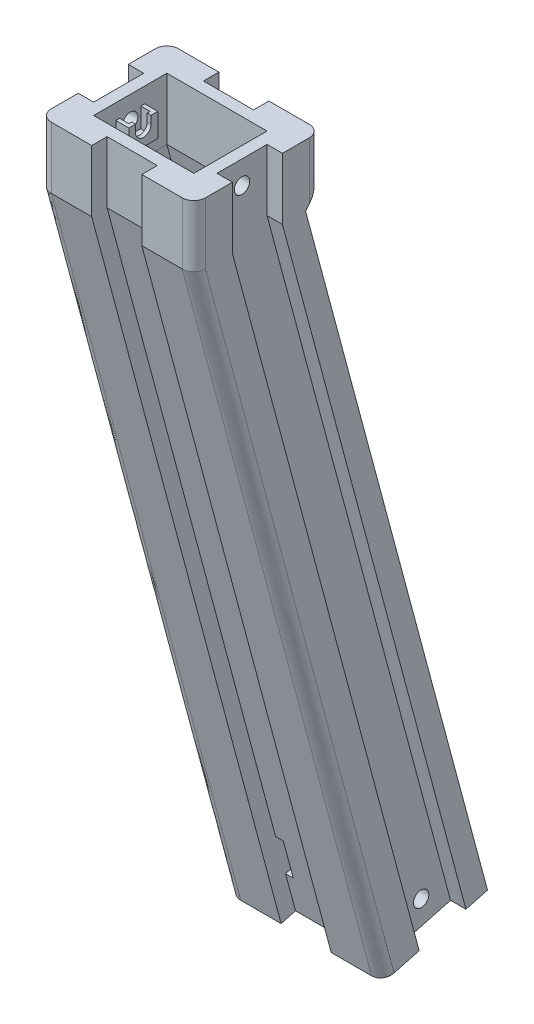
from build123d import *

# Parameters (mm, degrees)
BOSS_EXTRUDE1_DEPTH      = 16
SKETCH3_R                = 2
CUT_EXTRUDE1_DEPTH       = 55.267854205
SKETCH14_W               = 13
SKETCH14_H               = 4
SKETCH14_W_2             = 4
SKETCH14_H_2             = 13
CUT_EXTRUDE12_DEPTH      = 42.773197148
CUT_EXTRUDE17_DEPTH      = 185.668050728
CUT_EXTRUDE17_DEPTH_BACK = 185.668050728
BOSS_EXTRUDE2_DEPTH      = 16
SKETCH23_R               = 2
CUT_EXTRUDE16_DEPTH      = 202.8916363
SKETCH25_W               = 26
SKETCH25_H               = 19
CUT_EXTRUDE18_DEPTH      = 16
CUT_EXTRUDE19_DEPTH      = 200.66029351
CUT_EXTRUDE19_DEPTH_BACK = 200.66029351
SKETCH30_W               = 8
SKETCH30_H               = 7
CUT_EXTRUDE20_DEPTH      = 10
BOSS_EXTRUDE5_DEPTH      = 2.4
BOSS_EXTRUDE6_DEPTH      = 2.4
BOSS_EXTRUDE7_START      = 1
BOSS_EXTRUDE7_DEPTH      = 1
BOSS_EXTRUDE8_DEPTH      = 1
SKETCH37_W               = 3.4
SKETCH37_H               = 7.5
BOSS_EXTRUDE9_DEPTH      = 8.2
SKETCH38_W               = 2.4
SKETCH38_H               = 5.5
CUT_EXTRUDE21_DEPTH      = 5.3
CUT_EXTRUDE26_DEPTH      = 201.864269668
CUT_EXTRUDE26_DEPTH_BACK = 201.864269668
SKETCH40_R               = 2
CUT_EXTRUDE27_DEPTH      = 21
CUT_EXTRUDE27_DEPTH_BACK = 2
CUT_EXTRUDE28_DEPTH      = 5
SKETCH43_W               = 2
SKETCH43_H               = 10
CUT_EXTRUDE29_DEPTH      = 5
CUT_EXTRUDE30_DEPTH      = 5


with BuildPart() as part:
    # Sketch2 → Boss-Extrude1 (new body)
    with BuildSketch(Plane(origin=(0, 0, 0), x_dir=(1, 0, 0), z_dir=(0, 1, 0))):
        with BuildLine():
            Line((0, 33), (-17, 33))
            ThreePointArc((-17, 33), (-19.121320344, 32.121320344), (-20, 30))
            Line((-20, 30), (-20, 3))
            ThreePointArc((-20, 3), (-19.121320344, 0.878679656), (-17, 0))
            Line((-17, 0), (0, 0))
            Line((0, 0), (17, 0))
            ThreePointArc((17, 0), (19.121320344, 0.878679656), (20, 3))
            Line((20, 3), (20, 30))
            ThreePointArc((20, 30), (19.121320344, 32.121320344), (17, 33))
            Line((17, 33), (0, 33))
        make_face()
    extrude(amount=BOSS_EXTRUDE1_DEPTH)

    # Sketch3 → Cut-Extrude1 (cut, through all)
    with BuildSketch(Plane(origin=(20, 0, 0), x_dir=(0, 0, -1), z_dir=(1, 0, 0))):
        with Locations((16.5, 10)):
            Circle(SKETCH3_R)
    extrude(amount=-CUT_EXTRUDE1_DEPTH, mode=Mode.SUBTRACT)

    # Sketch14 → Cut-Extrude12 (cut, through all)
    with BuildSketch(Plane(origin=(0, 16, 0), x_dir=(1, 0, 0), z_dir=(0, 1, 0))):
        with Locations((0, 31)):
            Rectangle(SKETCH14_W, SKETCH14_H)
        with Locations((18, 16.5)):
            Rectangle(SKETCH14_W_2, SKETCH14_H_2)
        with Locations((0, 2)):
            Rectangle(SKETCH14_W, SKETCH14_H)
        with Locations((-18, 16.5)):
            Rectangle(SKETCH14_W_2, SKETCH14_H_2)
    extrude(amount=-CUT_EXTRUDE12_DEPTH, mode=Mode.SUBTRACT)

    # Sweep1: sweep along a path in Sketch18
    with BuildLine(Plane(origin=(0, 0, 0), x_dir=(0, 0, -1), z_dir=(1, 0, 0))) as sweep1_path:
        Line((16.5, 0), (61.515464328, -168))
    # Sketch20 → Sweep1 (sweep)
    with BuildSketch(Plane.XZ):
        with BuildLine():
            Line((20, -23), (20, -29))
            Line((20, -29), (-20, -29))
            Line((-20, -29), (-20, -23))
            Line((-20, -23), (-16, -23))
            Line((-16, -23), (-16, -10))
            Line((-16, -10), (-20, -10))
            Line((-20, -10), (-20, -3))
            ThreePointArc((-20, -3), (-19.121320344, -0.878679656), (-17, 0))
            Line((-17, 0), (-6.5, 0))
            Line((-6.5, 0), (-6.5, -4))
            Line((-6.5, -4), (6.5, -4))
            Line((6.5, -4), (6.5, 0))
            Line((6.5, 0), (17, 0))
            ThreePointArc((17, 0), (19.121320344, -0.878679656), (20, -3))
            Line((20, -3), (20, -10))
            Line((20, -10), (16, -10))
            Line((16, -10), (16, -23))
            Line((16, -23), (20, -23))
        make_face()
    sweep(path=sweep1_path.line)

    # Sketch24 → Cut-Extrude17 (cut, two sides: drawn at the far end of the back side and taken through both)
    with BuildSketch(Plane(origin=(0, 0, 0), x_dir=(0, 0, -1), z_dir=(1, 0, 0)).offset(-CUT_EXTRUDE17_DEPTH_BACK)):
        Polygon((45.015464328, -168), (74.015464328, -168), (74.015464328, -160.229473419), align=None)
    extrude(amount=CUT_EXTRUDE17_DEPTH + CUT_EXTRUDE17_DEPTH_BACK, mode=Mode.SUBTRACT)

    # Sketch22 → Boss-Extrude2 (add)
    with BuildSketch(Plane(origin=(0, -175.66697917, -16.401908526), x_dir=(1, 0, 0), z_dir=(0, -0.9659258262890671, -0.25881904510252524))):
        with BuildLine():
            Line((20, -39.282191022), (16, -39.282191022))
            Line((16, -39.282191022), (16, -51.839226764))
            Line((16, -51.839226764), (20, -51.839226764))
            Line((20, -51.839226764), (20, -57.634781721))
            Line((20, -57.634781721), (-20, -57.634781721))
            Line((-20, -57.634781721), (-20, -51.839226764))
            Line((-20, -51.839226764), (-16, -51.839226764))
            Line((-16, -51.839226764), (-16, -39.282191022))
            Line((-16, -39.282191022), (-20, -39.282191022))
            Line((-20, -39.282191022), (-20, -32.520710238))
            add(Edge.make_bspline(
                [(-20, -32.520710238), (-20, -30.823231492), (-18.757359313, -29.622932759), (-17, -29.622932759)],
                knots=[0, 0, 0, 0, 1, 1, 1, 1], degree=3, weights=[1, 0.804737854, 0.804737854, 1]))
            Line((-17, -29.622932759), (-6.5, -29.622932759))
            Line((-6.5, -29.622932759), (-6.5, -33.486636064))
            Line((-6.5, -33.486636064), (6.5, -33.486636064))
            Line((6.5, -33.486636064), (6.5, -29.622932759))
            Line((6.5, -29.622932759), (17, -29.622932759))
            add(Edge.make_bspline(
                [(17, -29.622932759), (18.757359313, -29.622932759), (20, -30.823231492), (20, -32.520710238)],
                knots=[0, 0, 0, 0, 1, 1, 1, 1], degree=3, weights=[1, 0.804737854, 0.804737854, 1]))
            Line((20, -32.520710238), (20, -39.282191022))
        make_face()
    extrude(amount=BOSS_EXTRUDE2_DEPTH)

    # Sketch23 → Cut-Extrude16 (cut, through all)
    with BuildSketch(Plane.ZY.offset(16)):
        with Locations((-62.998364361, -173.534258263)):
            Circle(SKETCH23_R)
    extrude(amount=-CUT_EXTRUDE16_DEPTH, mode=Mode.SUBTRACT)

    # Sketch25 → Cut-Extrude18 (cut)
    with BuildSketch(Plane(origin=(0, 16, 0), x_dir=(1, 0, 0), z_dir=(0, 1, 0))):
        with Locations((0, 16.5)):
            Rectangle(SKETCH25_W, SKETCH25_H)
    extrude(amount=-CUT_EXTRUDE18_DEPTH, mode=Mode.SUBTRACT)

    # Sketch27 → Cut-Loft1 section 0
    with BuildSketch(Plane(origin=(0, -183.454813221, -49.15656905), x_dir=(1, 0, 0), z_dir=(3.140994707002611e-15, -0.9659258262890654, -0.2588190451025318))):
        with BuildLine():
            Line((-13.102222521, -6.761480784), (13.102222521, -6.761480784))
            Line((13.102222521, -6.761480784), (13.102222521, -25.114071484))
            Line((13.102222521, -25.114071484), (-13.102222521, -25.114071484))
            Line((-13.102222521, -25.114071484), (-13.102222521, -6.761480784))
        make_face()
    # Sketch26 → Cut-Loft1 section 1
    with BuildSketch(Plane(origin=(0, 0, 0), x_dir=(1, 0, 0), z_dir=(0, 1, 0))):
        with BuildLine():
            Line((13, 7), (13, 26))
            Line((13, 26), (-13, 26))
            Line((-13, 26), (-13, 7))
            Line((-13, 7), (13, 7))
        make_face()
    loft(mode=Mode.SUBTRACT)

    # Sketch29 → Cut-Extrude19 (cut, two sides: drawn at the far end of the back side and taken through both)
    with BuildSketch(Plane(origin=(0, 0, 0), x_dir=(0, 0, -1), z_dir=(1, 0, 0)).offset(-CUT_EXTRUDE19_DEPTH_BACK)):
        Polygon((29, 0), (33, 4.76701437), (33, 0), align=None)
    extrude(amount=CUT_EXTRUDE19_DEPTH + CUT_EXTRUDE19_DEPTH_BACK, mode=Mode.SUBTRACT)

    # Sketch30 → Cut-Extrude20 (cut)
    with BuildSketch(Plane.ZY.offset(16)):
        with Locations((-16.5, 1.5)):
            Rectangle(SKETCH30_W, SKETCH30_H)
    extrude(amount=-CUT_EXTRUDE20_DEPTH, mode=Mode.SUBTRACT)

    # Sketch31 → Boss-Extrude5 (add)
    with BuildSketch(Plane(origin=(-13, 0, 0), x_dir=(0, 0, -1), z_dir=(1, 0, 0))):
        Polygon((13.75, 12), (13.75, 6.9), (19.25, 6.9), (19.25, 12), (20.25, 12), (20.25, 5.9), (12.75, 5.9), (12.75, 12), align=None)
    extrude(amount=BOSS_EXTRUDE5_DEPTH)

    # Sketch34 → Boss-Extrude6 (add)
    with BuildSketch(Plane.ZY.offset(-13)):
        Polygon((-12.75, 12), (-13.75, 12), (-13.75, 6.9), (-19.25, 6.9), (-19.25, 12), (-20.25, 12), (-20.25, 5.9), (-12.75, 5.9), align=None)
    extrude(amount=BOSS_EXTRUDE6_DEPTH)

    # Sketch35 → Boss-Extrude7 (add)
    with BuildSketch(Plane(origin=(-10.6, 0, 0), x_dir=(0, 0, -1), z_dir=(1, 0, 0)).offset(BOSS_EXTRUDE7_START)):
        with BuildLine():
            Line((12.75, 12), (14.5, 12))
            Line((14.5, 12), (14.5, 10))
            ThreePointArc((14.5, 10), (16.5, 8), (18.5, 10))
            Line((18.5, 10), (18.5, 12))
            Line((18.5, 12), (20.25, 12))
            Line((20.25, 12), (20.25, 5.9))
            Line((20.25, 5.9), (12.75, 5.9))
            Line((12.75, 5.9), (12.75, 12))
        make_face()
    extrude(amount=-BOSS_EXTRUDE7_DEPTH)

    # Sketch36 → Boss-Extrude8 (add)
    with BuildSketch(Plane.ZY.offset(-10.6)):
        with BuildLine():
            Line((-12.75, 5.9), (-12.75, 12))
            Line((-12.75, 12), (-14.5, 12))
            Line((-14.5, 12), (-14.5, 10))
            ThreePointArc((-14.5, 10), (-16.5, 8), (-18.5, 10))
            Line((-18.5, 10), (-18.5, 12))
            Line((-18.5, 12), (-20.25, 12))
            Line((-20.25, 12), (-20.25, 5.9))
            Line((-20.25, 5.9), (-12.75, 5.9))
        make_face()
    extrude(amount=BOSS_EXTRUDE8_DEPTH)

    # Sketch37 → Boss-Extrude9 (add)
    with BuildSketch(Plane(origin=(0, -183.454813221, -49.15656905), x_dir=(1, 0, 0), z_dir=(0, -0.9659258262890656, -0.25881904510253084))):
        with Locations((11.402222521, -15.937776134)):
            Rectangle(SKETCH37_W, SKETCH37_H)
        with Locations((-11.402222521, -15.937776134)):
            Rectangle(SKETCH37_W, SKETCH37_H)
    extrude(amount=-BOSS_EXTRUDE9_DEPTH)

    # Sketch38 → Cut-Extrude21 (cut)
    with BuildSketch(Plane(origin=(0, -175.534221445, -47.03425288), x_dir=(1, 0, 0), z_dir=(0, 0.9659258262890654, 0.2588190451025318))):
        with Locations((-11.897689531, 15.937776134)):
            Rectangle(SKETCH38_W, SKETCH38_H)
        with Locations((11.897689531, 15.937776134)):
            Rectangle(SKETCH38_W, SKETCH38_H)
    extrude(amount=-CUT_EXTRUDE21_DEPTH, mode=Mode.SUBTRACT)

    # Sketch40 → Cut-Extrude26 (cut, two sides: drawn at the far end of the back side and taken through both)
    with BuildSketch(Plane.ZY.offset(-9.702222521).offset(-CUT_EXTRUDE26_DEPTH_BACK)):
        with Locations((-62.998364361, -173.534258263)):
            Circle(SKETCH40_R)
    extrude(amount=CUT_EXTRUDE26_DEPTH + CUT_EXTRUDE26_DEPTH_BACK, mode=Mode.SUBTRACT)

    # Sketch41 → Cut-Extrude27 (cut, two sides: drawn at the far end of the back side and taken through both)
    with BuildSketch(Plane.ZY.offset(-9.702222521).offset(-CUT_EXTRUDE27_DEPTH_BACK)):
        Polygon((-64.930216013, -173.016620173), (-64.360814114, -170.891583355), (-60.497110809, -171.926859535), (-61.066512708, -174.051896353), align=None)
    extrude(amount=CUT_EXTRUDE27_DEPTH + CUT_EXTRUDE27_DEPTH_BACK, mode=Mode.SUBTRACT)

    # Sketch42 → Cut-Extrude28 (cut)
    with BuildSketch(Plane.ZY.offset(16)):
        Polygon((-55.898505618, -171.295554958), (-53.310315167, -161.636296695), (-55.24216682, -161.118658605), (-57.830357271, -170.777916868), align=None)
    extrude(amount=-CUT_EXTRUDE28_DEPTH, mode=Mode.SUBTRACT)

    # Sketch43 → Cut-Extrude29 (cut)
    with BuildSketch(Plane(origin=(0, 1, -3.732050808), x_dir=(1, 0, 0), z_dir=(0, -0.25881904510252507, 0.9659258262890671))):
        with Locations((-5.5, -174.926398309)):
            Rectangle(SKETCH43_W, SKETCH43_H)
        with Locations((5.5, -6.03527618)):
            Rectangle(SKETCH43_W, SKETCH43_H)
    extrude(amount=-CUT_EXTRUDE29_DEPTH, mode=Mode.SUBTRACT)

    # Sketch44 → Cut-Extrude30 (cut)
    with BuildSketch(Plane(origin=(16, 0, 0), x_dir=(0, 0, -1), z_dir=(1, 0, 0))):
        Polygon((10, 0), (12.588190451, -9.659258263), (14.520042104, -9.141620173), (11.931851653, 0.51763809), align=None)
    extrude(amount=-CUT_EXTRUDE30_DEPTH, mode=Mode.SUBTRACT)


solid = part.part
